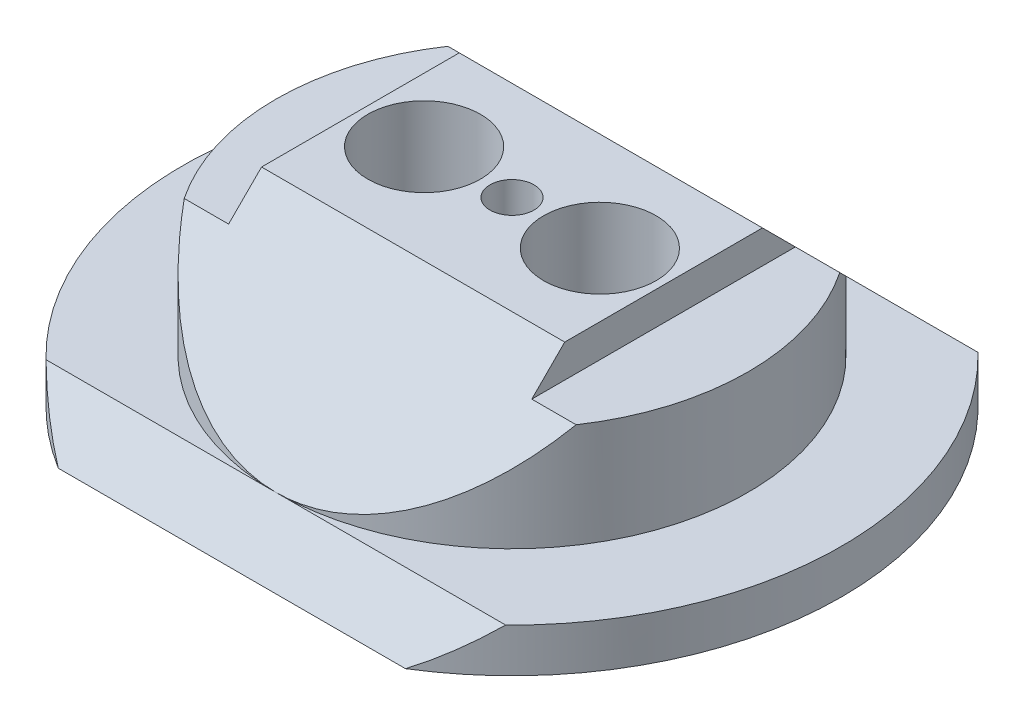
from build123d import *
from build123d.topology import SkipClean

# Parameters (mm, degrees)
SKETCH1_R                            = 30
BOSS_EXTRUDE1_DEPTH                  = 4
BOSS_EXTRUDE2_REACH                  = 44.615
BOSS_EXTRUDE2_END_RADIUS             = 30
BOSS_EXTRUDE2_DIRECTION_2_REACH      = 44.615
BOSS_EXTRUDE2_DIRECTION_2_END_RADIUS = 30
SKETCH3_OUTSIDE_W                    = 78.092
SKETCH3_OUTSIDE_H                    = 69.092
SKETCH3_OUTSIDE_R                    = 21.5
CUT_EXTRUDE2_DEPTH                   = 12.5
BOSS_EXTRUDE3_DEPTH                  = 18
BOSS_EXTRUDE4_DEPTH                  = 15
BOSS_EXTRUDE5_DEPTH                  = 15
CUT_EXTRUDE3_DEPTH                   = 44.292609069
CUT_EXTRUDE3_DEPTH_BACK              = 44.292609069
SKETCH8_R                            = 2
CUT_EXTRUDE8_DEPTH                   = 48.077064479
CUT_EXTRUDE8_DEPTH_BACK              = 48.077064479
CUT_EXTRUDE9_DEPTH                   = 59.659818207
CUT_EXTRUDE11_DEPTH                  = 20
CUT_EXTRUDE12_DEPTH                  = 20
CUT_EXTRUDE13_DEPTH                  = 20
CUT_EXTRUDE14_DEPTH                  = 44.292609069
CUT_EXTRUDE14_DEPTH_BACK             = 44.292609069
SKETCH25_W                           = 66.075437062
SKETCH25_H                           = 20.142243048
SKETCH26_R                           = 5.125
CUT_EXTRUDE15_DEPTH                  = 24
CUT_EXTRUDE17_DEPTH                  = 47.524187258
CUT_EXTRUDE17_DEPTH_BACK             = 47.524187258
SKETCH29_W                           = 7.7
SKETCH29_H                           = 3
CUT_EXTRUDE18_DEPTH                  = 47.524187258
CUT_EXTRUDE18_DEPTH_BACK             = 47.524187258
SKETCH31_W                           = 7.7
SKETCH31_H                           = 3
SKETCH34_R                           = 1.5
CUT_EXTRUDE21_DEPTH                  = 20
SKETCH35_R                           = 2
CUT_EXTRUDE22_DEPTH                  = 3
SKETCH37_R                           = 5
CUT_EXTRUDE23_DEPTH                  = 3


with BuildPart() as part:
    # Sketch1 → Boss-Extrude1 (new body)
    with BuildSketch(Plane(origin=(0, 0, 0), x_dir=(1, 0, 0), z_dir=(0, 1, 0))):
        with Locations(Location((0, 0, 0), (0, 0, 270))):
            Circle(SKETCH1_R)
    extrude(amount=BOSS_EXTRUDE1_DEPTH)

    # Boss-Extrude2: up to this cylinder (the profile starts inside it)
    with SkipClean():  # the faces are left unmerged after this step: merging them gives an invalid solid
        boss_extrude2_end = Plane(origin=(0, 9.396175, 0), z_dir=(0, -1, 0)) * Cylinder(BOSS_EXTRUDE2_END_RADIUS, 150.23, mode=Mode.PRIVATE)
        # Sketch2 → Boss-Extrude2 (add, up to the surface)
        with BuildSketch(Plane(origin=(0, 0, 0), x_dir=(0, 0, -1), z_dir=(1, 0, 0)), mode=Mode.PRIVATE) as boss_extrude2_sk1:
            Polygon((0, 4), (21.5, 4), (9, 16.5), (-9, 16.5), (-21.5, 4), align=None)
        boss_extrude2_tool1 = extrude(boss_extrude2_sk1.sketch, amount=BOSS_EXTRUDE2_REACH, mode=Mode.PRIVATE) & boss_extrude2_end
        add(boss_extrude2_tool1.solids().sort_by_distance((0, 9.396175, 0))[0])

    # Boss-Extrude2 direction 2: up to this cylinder (the profile starts inside it)
    with SkipClean():  # the faces are left unmerged after this step: merging them gives an invalid solid
        boss_extrude2_direction_2_end = Plane(origin=(0, 9.396175, 0), z_dir=(0, -1, 0)) * Cylinder(BOSS_EXTRUDE2_DIRECTION_2_END_RADIUS, 150.23, mode=Mode.PRIVATE)
        # Sketch2 → Boss-Extrude2 direction 2 (add, up to the surface)
        with BuildSketch(Plane(origin=(0, 0, 0), x_dir=(0, 0, -1), z_dir=(1, 0, 0)), mode=Mode.PRIVATE) as boss_extrude2_direction_2_sk1:
            Polygon((0, 4), (21.5, 4), (9, 16.5), (-9, 16.5), (-21.5, 4), align=None)
        boss_extrude2_direction_2_tool1 = extrude(boss_extrude2_direction_2_sk1.sketch, amount=-BOSS_EXTRUDE2_DIRECTION_2_REACH, mode=Mode.PRIVATE) & boss_extrude2_direction_2_end
        add(boss_extrude2_direction_2_tool1.solids().sort_by_distance((0, 9.396175, 0))[0])

    # SurfaceCut1
    split(bisect_by=Plane(origin=(0, 12.75, -12.75), x_dir=(1, 0, 0), z_dir=(0, 0.7071067811865558, -0.7071067811865392)), keep=Keep.BOTTOM)

    # SurfaceCut2
    split(bisect_by=Plane(origin=(0, 12.75, 12.75), x_dir=(1, 0, 0), z_dir=(0, 0.7071067811865509, 0.7071067811865442)), keep=Keep.BOTTOM)

    # Sketch3 outside → Cut-Extrude2 (cut)
    with BuildSketch(Plane(origin=(0, 4, 0), x_dir=(1, 0, 0), z_dir=(0, 1, 0))):
        Rectangle(SKETCH3_OUTSIDE_W, SKETCH3_OUTSIDE_H)
        Circle(SKETCH3_OUTSIDE_R, mode=Mode.SUBTRACT)
    extrude(amount=CUT_EXTRUDE2_DEPTH, mode=Mode.SUBTRACT)

    # Sketch5 → Boss-Extrude3 (add)
    with BuildSketch(Plane(origin=(0, 0, 0), x_dir=(-1, 0, 0), z_dir=(0, -1, 0))):
        Polygon((0, -6), (-17.5, -6), (-17.5, 6), (17.5, 6), (17.5, -6), align=None)
    extrude(amount=BOSS_EXTRUDE3_DEPTH)

    # Sketch6 → Boss-Extrude4 (add)
    with BuildSketch(Plane.XZ):
        Polygon((0, 15), (7, 15), (7, 6), (-7, 6), (-7, 15), align=None)
    extrude(amount=BOSS_EXTRUDE4_DEPTH)

    # Sketch7 → Boss-Extrude5 (add)
    with BuildSketch(Plane.XZ):
        Polygon((0, -15), (7, -15), (7, -6), (-7, -6), (-7, -15), align=None)
    extrude(amount=BOSS_EXTRUDE5_DEPTH)

    # Sketch8 → Cut-Extrude3 (cut, two sides: drawn at the far end of the back side and taken through both)
    with BuildSketch(Plane.XY.offset(-CUT_EXTRUDE3_DEPTH_BACK)):
        with Locations((-12.5, -12.5)):
            Circle(SKETCH8_R)
        with Locations((12.5, -12.5)):
            Circle(SKETCH8_R)
    extrude(amount=CUT_EXTRUDE3_DEPTH + CUT_EXTRUDE3_DEPTH_BACK, mode=Mode.SUBTRACT)

    # Sketch16 → Cut-Extrude8 (cut, two sides: drawn at the far end of the back side and taken through both)
    with BuildSketch(Plane.XY.offset(6).offset(-CUT_EXTRUDE8_DEPTH_BACK)):
        Polygon((17.5, -18), (17.5, -14.5), (14, -18), align=None)
        Polygon((-17.5, -18), (-14, -18), (-17.5, -14.5), align=None)
    extrude(amount=CUT_EXTRUDE8_DEPTH + CUT_EXTRUDE8_DEPTH_BACK, mode=Mode.SUBTRACT)

    # Sketch17 → Cut-Extrude9 (cut, through all)
    with BuildSketch(Plane(origin=(10.365975269, -9.674910251, -8.062425209), x_dir=(-0.3613483622370374, 0.337258471421235, -0.8693009171531012), z_dir=(0.6355070151731325, -0.5931398808282571, -0.49428323402354774))):
        Polygon((-2.372510104, -6.189601271), (7.980636686, -0.706686759), (7.980636686, -10.965829024), align=None)
    extrude(amount=CUT_EXTRUDE9_DEPTH, mode=Mode.SUBTRACT)

    # Sketch19 → Cut-Extrude11 (cut)
    with BuildSketch(Plane(origin=(-10.365975269, -9.674910251, -8.062425209), x_dir=(0.3613483622370374, 0.33725847142123494, -0.8693009171531012), z_dir=(0.6355070151731324, 0.5931398808282571, 0.4942832340235476))):
        Polygon((-2.372510104, -6.189601271), (7.980636686, -10.965829024), (7.980636686, -0.706686759), align=None)
    extrude(amount=-CUT_EXTRUDE11_DEPTH, mode=Mode.SUBTRACT)

    # Sketch20 → Cut-Extrude12 (cut)
    with BuildSketch(Plane(origin=(-10.365975269, -9.674910251, 8.062425209), x_dir=(-0.3613483622370374, -0.3372584714212349, -0.8693009171531013), z_dir=(0.6355070151731326, 0.593139880828257, -0.49428323402354757))):
        Polygon((2.372510104, -6.189601271), (-7.980636686, -0.706686759), (-7.980636686, -10.965829024), align=None)
    extrude(amount=-CUT_EXTRUDE12_DEPTH, mode=Mode.SUBTRACT)

    # Sketch21 → Cut-Extrude13 (cut)
    with BuildSketch(Plane(origin=(10.365975269, -9.674910251, 8.062425209), x_dir=(-0.3613483622370374, 0.3372584714212349, 0.8693009171531013), z_dir=(-0.6355070151731326, 0.593139880828257, -0.49428323402354757))):
        Polygon((-2.372510104, -6.189601271), (7.980636686, -0.706686759), (7.980636686, -10.965829024), align=None)
    extrude(amount=-CUT_EXTRUDE13_DEPTH, mode=Mode.SUBTRACT)

    # Sketch25 → Cut-Extrude14 (cut, two sides: drawn at the far end of the back side and taken through both)
    with BuildSketch(Plane.XY.offset(-CUT_EXTRUDE14_DEPTH_BACK)):
        with Locations((0, -10.071121524)):
            Rectangle(SKETCH25_W, SKETCH25_H)
    extrude(amount=CUT_EXTRUDE14_DEPTH + CUT_EXTRUDE14_DEPTH_BACK, mode=Mode.SUBTRACT)

    # Sketch26 → Cut-Extrude15 (cut)
    with BuildSketch(Plane(origin=(0, 16.5, 0), x_dir=(1, 0, 0), z_dir=(0, 1, 0))):
        with Locations(Location((-8, 0, 0), (0, 0, 270))):
            Circle(SKETCH26_R)
        with Locations(Location((8, 0, 0), (0, 0, 270))):
            Circle(SKETCH26_R)
    extrude(amount=-CUT_EXTRUDE15_DEPTH, mode=Mode.SUBTRACT)

    # Sketch29 → Cut-Extrude17 (cut, two sides: drawn at the far end of the back side and taken through both)
    with BuildSketch(Plane.XY.offset(6).offset(-CUT_EXTRUDE17_DEPTH_BACK)):
        with Locations((17.65, 15)):
            Rectangle(SKETCH29_W, SKETCH29_H)
    extrude(amount=CUT_EXTRUDE17_DEPTH + CUT_EXTRUDE17_DEPTH_BACK, mode=Mode.SUBTRACT)

    # Sketch31 → Cut-Extrude18 (cut, two sides: drawn at the far end of the back side and taken through both)
    with BuildSketch(Plane.XY.offset(6).offset(-CUT_EXTRUDE18_DEPTH_BACK)):
        with Locations((-17.65, 15)):
            Rectangle(SKETCH31_W, SKETCH31_H)
    extrude(amount=CUT_EXTRUDE18_DEPTH + CUT_EXTRUDE18_DEPTH_BACK, mode=Mode.SUBTRACT)

    # Sketch34 → Cut-Extrude21 (cut)
    with BuildSketch(Plane.XZ):
        with Locations(Location((0, 0, 0), (0, 0, 270))):
            Circle(SKETCH34_R)
    extrude(amount=-CUT_EXTRUDE21_DEPTH, mode=Mode.SUBTRACT)

    # Sketch35 → Cut-Extrude22 (cut)
    with BuildSketch(Plane(origin=(0, 16.5, 0), x_dir=(1, 0, 0), z_dir=(0, 1, 0))):
        with Locations(Location((0, 0, 0), (0, 0, 270))):
            Circle(SKETCH35_R)
    extrude(amount=-CUT_EXTRUDE22_DEPTH, mode=Mode.SUBTRACT)

    # Sketch37 → Cut-Extrude23 (cut)
    with BuildSketch(Plane.XZ):
        with Locations(Location((0, -15, 0), (0, 0, 270))):
            Circle(SKETCH37_R)
        with Locations(Location((0, 15, 0), (0, 0, 270))):
            Circle(SKETCH37_R)
        with Locations(Location((-22, 0, 0), (0, 0, 270))):
            Circle(SKETCH37_R)
        with Locations(Location((22, 0, 0), (0, 0, 270))):
            Circle(SKETCH37_R)
        with Locations(Location((-14, 12, 0), (0, 0, 270))):
            Circle(SKETCH37_R)
        with Locations(Location((14, 12, 0), (0, 0, 270))):
            Circle(SKETCH37_R)
        with Locations(Location((-14, -12, 0), (0, 0, 270))):
            Circle(SKETCH37_R)
        with Locations(Location((14, -12, 0), (0, 0, 270))):
            Circle(SKETCH37_R)
    extrude(amount=-CUT_EXTRUDE23_DEPTH, mode=Mode.SUBTRACT)


solid = part.part
